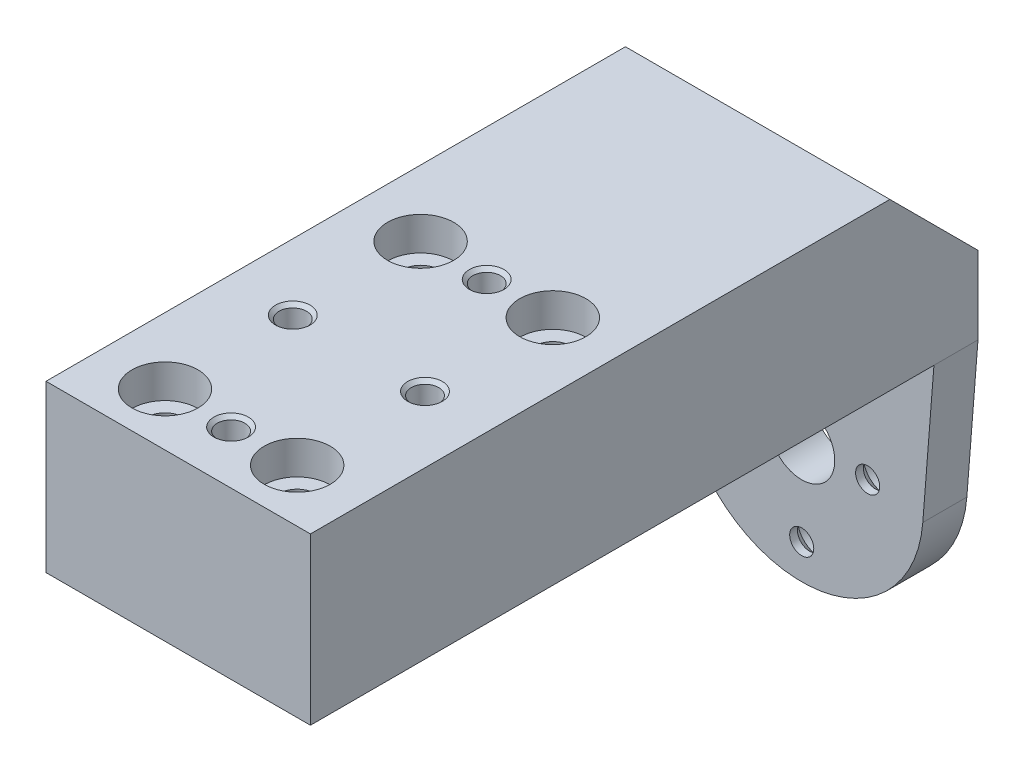
from build123d import *

# Parameters (mm, degrees)
SKETCH1_W                                       = 38.1
SKETCH1_H                                       = 23.876
GEARBOX_MOUNT_DEPTH                             = 48.26
CBORE_FOR_4_SOCKET_HEAD_CAP_SCREW1_D            = 3.2639
CBORE_FOR_4_SOCKET_HEAD_CAP_SCREW1_DEPTH        = 12.7
CBORE_FOR_4_SOCKET_HEAD_CAP_SCREW1_CBORE_D      = 3.96875
CBORE_FOR_4_SOCKET_HEAD_CAP_SCREW1_CBORE_DEPTH  = 4.7625
CBORE_FOR_4_SOCKET_HEAD_CAP_SCREW1_TIP          = 0.980574487
INSERT_INSTALLATION_CHAMFERS_SIZE               = 0.508
SKETCH7_W                                       = 38.1
SKETCH7_H                                       = 23.876
MOTOR_MOUNT_EXTENSION_DEPTH                     = 41.5798
CBORE_FOR_10_SOCKET_HEAD_CAP_SCREW1_D           = 5.1054
CBORE_FOR_10_SOCKET_HEAD_CAP_SCREW1_CBORE_D     = 9.525
CBORE_FOR_10_SOCKET_HEAD_CAP_SCREW1_CBORE_DEPTH = 4.826
MOTOR_MOUNT_PLATE_DEPTH                         = 6.35
SHAFT_CLEARANCE_REACH                           = 111.391
SKETCH9_R                                       = 4.7625
CSK_FOR_M3_FLAT_HEAD_MACHINE_SCREW1_AT_2_COUNT  = 2
CSK_FOR_M3_FLAT_HEAD_MACHINE_SCREW1_AT_2_PITCH  = 19
CSK_FOR_M3_FLAT_HEAD_MACHINE_SCREW1_AT_3_COUNT  = 2
CSK_FOR_M3_FLAT_HEAD_MACHINE_SCREW1_AT_3_PITCH  = 15.700318468
CSK_FOR_M3_FLAT_HEAD_MACHINE_SCREW1_AT_4_COUNT  = 2
CSK_FOR_M3_FLAT_HEAD_MACHINE_SCREW1_AT_4_PITCH  = 15.700318468
CHAMFER2_SIZE                                   = 12.7
CUT_EXTRUDE1_REACH                              = 78.048
SKETCH12_R                                      = 2.6035
SKETCH13_R                                      = 1.73482
CUT_EXTRUDE2_DEPTH                              = 104.851713072


with BuildPart() as part:
    # Sketch1 → Gearbox Mount (new body)
    with BuildSketch(Plane.XY):
        Rectangle(SKETCH1_W, SKETCH1_H)
    extrude(amount=GEARBOX_MOUNT_DEPTH)

    # CBORE for #4 Socket Head Cap Screw1
    with Locations(Plane(origin=(0, 11.938, 0), x_dir=(1, 0, 0), z_dir=(0, 1, 0))):
        with Locations((0, -3.81), (-9.525, -22.225), (0, -40.64), (9.525, -22.225)):
            CounterBoreHole(CBORE_FOR_4_SOCKET_HEAD_CAP_SCREW1_D / 2, CBORE_FOR_4_SOCKET_HEAD_CAP_SCREW1_CBORE_D / 2, CBORE_FOR_4_SOCKET_HEAD_CAP_SCREW1_CBORE_DEPTH, depth=CBORE_FOR_4_SOCKET_HEAD_CAP_SCREW1_DEPTH)
            with Locations((0, 0, -(CBORE_FOR_4_SOCKET_HEAD_CAP_SCREW1_DEPTH + CBORE_FOR_4_SOCKET_HEAD_CAP_SCREW1_TIP / 2))):  # 118° drill point
                Cone(0, CBORE_FOR_4_SOCKET_HEAD_CAP_SCREW1_D / 2, CBORE_FOR_4_SOCKET_HEAD_CAP_SCREW1_TIP, mode=Mode.SUBTRACT)

    # Insert Installation Chamfers
    insert_installation_chamfers_edges = [part.edges().sort_by_distance(p)[0] for p in [
        (7.540625, 11.938, 22.225),
        (-1.984375, 11.938, 40.64),
        (-11.509375, 11.938, 22.225),
        (-1.984375, 11.938, 3.81),
    ]]
    chamfer(insert_installation_chamfers_edges, length=INSERT_INSTALLATION_CHAMFERS_SIZE)

    # Sketch7 → Motor Mount Extension (add)
    with BuildSketch(Plane(origin=(0, 0, 0), x_dir=(-1, 0, 0), z_dir=(0, 0, -1))):
        Rectangle(SKETCH7_W, SKETCH7_H)
    extrude(amount=MOTOR_MOUNT_EXTENSION_DEPTH)

    # CBORE for #10 Socket Head Cap Screw1 (through all)
    with Locations(Plane(origin=(0, 11.938, 0), x_dir=(1, 0, 0), z_dir=(0, 1, 0))):
        with Locations((-9.525, -40.64), (9.525, -40.64), (9.525, -3.81), (-9.525, -3.81)):
            CounterBoreHole(CBORE_FOR_10_SOCKET_HEAD_CAP_SCREW1_D / 2, CBORE_FOR_10_SOCKET_HEAD_CAP_SCREW1_CBORE_D / 2, CBORE_FOR_10_SOCKET_HEAD_CAP_SCREW1_CBORE_DEPTH)

    # Sketch8 → Motor Mount Plate (add)
    with BuildSketch(Plane(origin=(0, 0, -41.5798), x_dir=(-1, 0, 0), z_dir=(0, 0, -1))):
        with BuildLine():
            Line((19.05, 11.938), (-19.05, 11.938))
            Line((-19.05, 11.938), (-19.05, -11.938))
            Line((-19.05, -11.938), (-17.446279027, -32.358163541))
            ThreePointArc((-17.446279027, -32.358163541), (0, -48.488), (17.446279027, -32.358163541))
            Line((17.446279027, -32.358163541), (19.05, -11.938))
            Line((19.05, -11.938), (19.05, 11.938))
        make_face()
    extrude(amount=MOTOR_MOUNT_PLATE_DEPTH)

    # Sketch9 → Shaft Clearance (cut, up to next)
    with BuildSketch(Plane(origin=(0, 0, -47.9298), x_dir=(-1, 0, 0), z_dir=(0, 0, -1)), mode=Mode.PRIVATE) as shaft_clearance_sk1:
        with Locations((0, -30.988)):
            Circle(SKETCH9_R)
    shaft_clearance_tool1 = extrude(shaft_clearance_sk1.sketch, amount=-SHAFT_CLEARANCE_REACH, mode=Mode.PRIVATE) & part.part
    add(shaft_clearance_tool1.solids().sort_by_distance((0, -30.988, -47.9298))[0], mode=Mode.SUBTRACT)

    # Sketch10 → CSK for M3 Flat Head Machine Screw1 (revolve, cut)
    with BuildSketch(Plane(origin=(9.5, -30.988, -47.9298), x_dir=(0, 1, 0), z_dir=(1, 0, 0))):
        Polygon((0, 0), (0, 6.35), (1.7, 6.35), (1.7, 5.26), (3.15, 3.81), (3.15, 0), align=None)
    csk_for_m3_flat_head_machine_screw1 = revolve(axis=Axis((9.5, -30.988, -54.2798), (0, 0, 1)), mode=Mode.SUBTRACT)

    # CSK for M3 Flat Head Machine Screw1 at 2: CSK for M3 Flat Head Machine Screw1 ×2
    with Locations(*[(-i * CSK_FOR_M3_FLAT_HEAD_MACHINE_SCREW1_AT_2_PITCH, 0, 0) for i in range(1, CSK_FOR_M3_FLAT_HEAD_MACHINE_SCREW1_AT_2_COUNT)]):
        add(csk_for_m3_flat_head_machine_screw1, mode=Mode.SUBTRACT)

    # CSK for M3 Flat Head Machine Screw1 at 3: CSK for M3 Flat Head Machine Screw1 ×2
    with Locations(*[Vector(-0.6050832675335578, 0.7961621941231026, 0) * (i * CSK_FOR_M3_FLAT_HEAD_MACHINE_SCREW1_AT_3_PITCH) for i in range(1, CSK_FOR_M3_FLAT_HEAD_MACHINE_SCREW1_AT_3_COUNT)]):
        add(csk_for_m3_flat_head_machine_screw1, mode=Mode.SUBTRACT)

    # CSK for M3 Flat Head Machine Screw1 at 4: CSK for M3 Flat Head Machine Screw1 ×2
    with Locations(*[Vector(-0.605083267533558, -0.7961621941231024, 0) * (i * CSK_FOR_M3_FLAT_HEAD_MACHINE_SCREW1_AT_4_PITCH) for i in range(1, CSK_FOR_M3_FLAT_HEAD_MACHINE_SCREW1_AT_4_COUNT)]):
        add(csk_for_m3_flat_head_machine_screw1, mode=Mode.SUBTRACT)

    # Chamfer2
    chamfer2_edges = [part.edges().sort_by_distance(p)[0] for p in [
        (0, 11.938, -47.9298),
    ]]
    chamfer(chamfer2_edges, length=CHAMFER2_SIZE)

    # Sketch12 → Cut-Extrude1 (cut, up to next)
    with BuildSketch(Plane(origin=(0, 7.112, 0), x_dir=(1, 0, 0), z_dir=(0, 1, 0)), mode=Mode.PRIVATE) as cut_extrude1_sk1:
        with Locations(Location((-9.525, -3.81, 0), (0, 0, 270))):
            Circle(SKETCH12_R)
    cut_extrude1_tool1 = extrude(cut_extrude1_sk1.sketch, amount=-CUT_EXTRUDE1_REACH, mode=Mode.PRIVATE) & part.part
    # Sketch12 → Cut-Extrude1 (cut, up to next)
    with BuildSketch(Plane(origin=(0, 7.112, 0), x_dir=(1, 0, 0), z_dir=(0, 1, 0)), mode=Mode.PRIVATE) as cut_extrude1_sk2:
        with Locations(Location((9.525, -3.81, 0), (0, 0, 270))):
            Circle(SKETCH12_R)
    cut_extrude1_tool2 = extrude(cut_extrude1_sk2.sketch, amount=-CUT_EXTRUDE1_REACH, mode=Mode.PRIVATE) & part.part
    # Sketch12 → Cut-Extrude1 (cut, up to next)
    with BuildSketch(Plane(origin=(0, 7.112, 0), x_dir=(1, 0, 0), z_dir=(0, 1, 0)), mode=Mode.PRIVATE) as cut_extrude1_sk3:
        with Locations(Location((-9.525, -40.64, 0), (0, 0, 270))):
            Circle(SKETCH12_R)
    cut_extrude1_tool3 = extrude(cut_extrude1_sk3.sketch, amount=-CUT_EXTRUDE1_REACH, mode=Mode.PRIVATE) & part.part
    # Sketch12 → Cut-Extrude1 (cut, up to next)
    with BuildSketch(Plane(origin=(0, 7.112, 0), x_dir=(1, 0, 0), z_dir=(0, 1, 0)), mode=Mode.PRIVATE) as cut_extrude1_sk4:
        with Locations(Location((9.525, -40.64, 0), (0, 0, 270))):
            Circle(SKETCH12_R)
    cut_extrude1_tool4 = extrude(cut_extrude1_sk4.sketch, amount=-CUT_EXTRUDE1_REACH, mode=Mode.PRIVATE) & part.part
    add(cut_extrude1_tool1.solids().sort_by_distance((-9.525, 7.112, 3.81))[0], mode=Mode.SUBTRACT)
    add(cut_extrude1_tool2.solids().sort_by_distance((9.525, 7.112, 3.81))[0], mode=Mode.SUBTRACT)
    add(cut_extrude1_tool3.solids().sort_by_distance((-9.525, 7.112, 40.64))[0], mode=Mode.SUBTRACT)
    add(cut_extrude1_tool4.solids().sort_by_distance((9.525, 7.112, 40.64))[0], mode=Mode.SUBTRACT)

    # Sketch13 → Cut-Extrude2 (cut, through all)
    with BuildSketch(Plane.XY.offset(-41.5798)):
        with Locations((0, -18.488)):
            Circle(SKETCH13_R)
        with Locations((-9.5, -30.988)):
            Circle(SKETCH13_R)
        with Locations((9.5, -30.988)):
            Circle(SKETCH13_R)
        with Locations((0, -43.488)):
            Circle(SKETCH13_R)
    extrude(amount=-CUT_EXTRUDE2_DEPTH, mode=Mode.SUBTRACT)


solid = part.part
